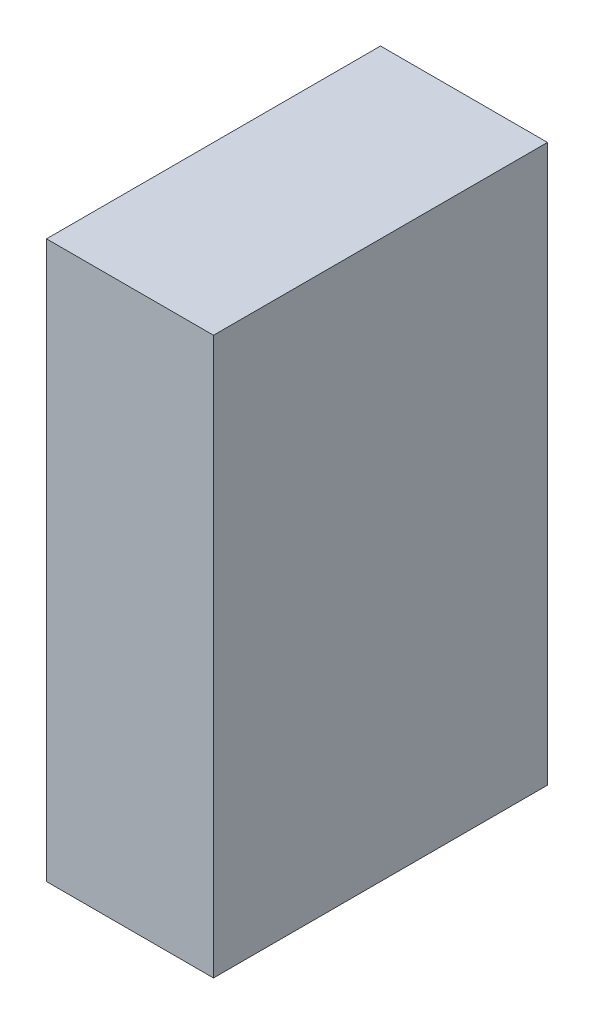
from build123d import *

# Parameters (mm, degrees)
SKETCH_1_W      = 6
SKETCH_1_H      = 20
EXTRUDE_1_DEPTH = 12


with BuildPart() as part:
    # 草圖1 → 填料-伸長1 (new body)
    with BuildSketch(Plane.XY):
        Rectangle(SKETCH_1_W, SKETCH_1_H)
    extrude(amount=EXTRUDE_1_DEPTH)


solid = part.part
